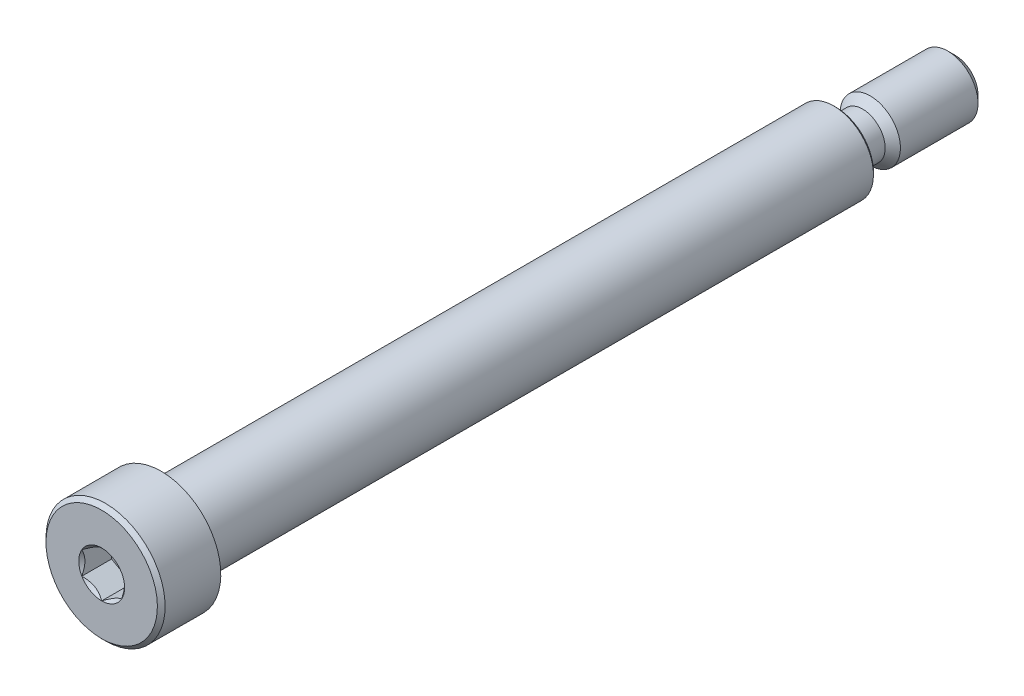
from build123d import *

# Parameters (mm, degrees)
CHAMFER1_SIZE      = 0.60325
CHAMFER2_SIZE      = 0.3095625
CHAMFER3_SIZE      = 0.2032
CUT_EXTRUDE2_DEPTH = 2.38125


with BuildPart() as part:
    # Sketch1 → Revolve1 (revolve)
    with BuildSketch(Plane(origin=(0, 0, 0), x_dir=(0, 0, -1), z_dir=(1, 0, 0))):
        Polygon((0, 4.7625), (4.7625, 4.7625), (4.7625, 3.175), (58.7375, 3.175), (58.7375, 2.413), (68.2625, 2.413), (68.2625, 0), (0, 0), align=None)
    revolve(axis=Axis((0, 0, -68.2625), (0, 0, 1)))

    # Sketch5 → Cut-Revolve1 (revolve, cut)
    with BuildSketch(Plane(origin=(0, 0, 0), x_dir=(0, 0, -1), z_dir=(1, 0, 0))):
        with BuildLine():
            Line((58.7375, 3.175), (62.2173, 3.175))
            Line((62.2173, 3.175), (60.8457, 1.8034))
            Line((60.8457, 1.8034), (59.3471, 1.8034))
            ThreePointArc((59.3471, 1.8034), (58.916047706, 1.981947706), (58.7375, 2.413))
            Line((58.7375, 2.413), (58.7375, 3.175))
        make_face()
    revolve(axis=Axis((0, 0, -68.2625), (0, 0, 1)), mode=Mode.SUBTRACT)

    # Chamfer1
    chamfer1_edges = [part.edges().sort_by_distance(p)[0] for p in [
        (0, -2.413, -68.2625),
    ]]
    chamfer(chamfer1_edges, length=CHAMFER1_SIZE)

    # Chamfer2
    chamfer2_edges = [part.edges().sort_by_distance(p)[0] for p in [
        (0, -4.7625, 0),
    ]]
    chamfer(chamfer2_edges, length=CHAMFER2_SIZE)

    # Chamfer3
    chamfer3_edges = [part.edges().sort_by_distance(p)[0] for p in [
        (0, -3.175, -58.7375),
    ]]
    chamfer(chamfer3_edges, length=CHAMFER3_SIZE)

    # Sketch8 → Cut-Extrude2 (cut)
    with BuildSketch(Plane.XY):
        Polygon((1.5875, 0.916543552), (0, 1.833087105), (-1.5875, 0.916543552), (-1.5875, -0.916543552), (0, -1.833087105), (1.5875, -0.916543552), align=None)
    extrude(amount=-CUT_EXTRUDE2_DEPTH, mode=Mode.SUBTRACT)

    # Cut-Extrude4 cone 1 section (through the dimple's axis) → Cut-Extrude4 (revolve, cut)
    with BuildSketch(Plane(origin=(0, 0, 0), x_dir=(0, -1, 0), z_dir=(1, 0, 0))):
        Polygon((0, 0), (1.833087105, 0), (0, 1.833087105), align=None)
    revolve(axis=Axis((0, 0, 0), (0, 0, -1)), mode=Mode.SUBTRACT)


solid = part.part
